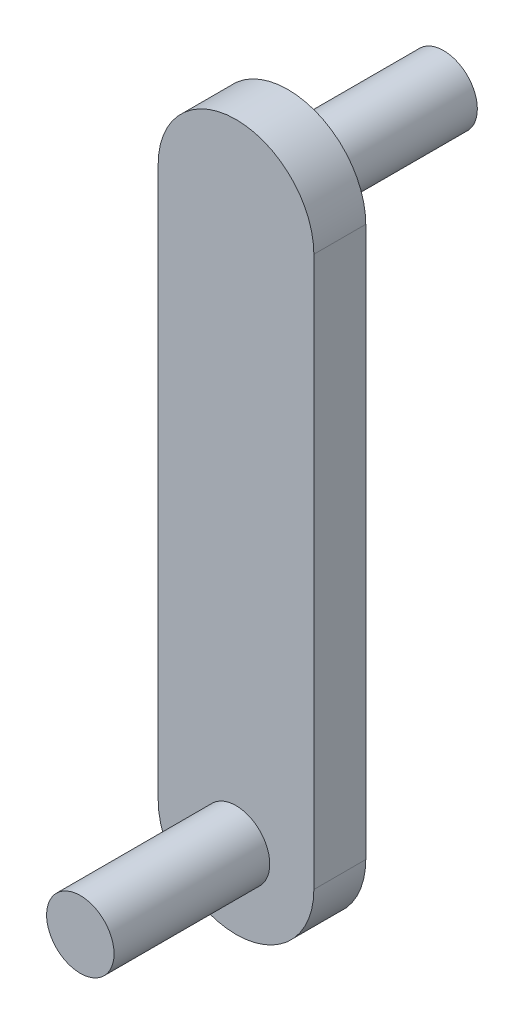
from build123d import *

# Parameters (mm, degrees)
BOSS_EXTRUDE1_DEPTH = 2.5
SKETCH1_3_R         = 3.25
BOSS_EXTRUDE2_DEPTH = 17.5
SKETCH1_4_R         = 3.25
BOSS_EXTRUDE3_DEPTH = 17.5


with BuildPart() as part:
    # Sketch1 → Boss-Extrude1 (new, symmetric)
    with BuildSketch(Plane.XY):
        with BuildLine():
            Line((7.5, -53), (7.5, 0))
            ThreePointArc((7.5, 0), (0, 7.5), (-7.5, 0))
            Line((-7.5, 0), (-7.5, -53))
            ThreePointArc((-7.5, -53), (0, -60.5), (7.5, -53))
        make_face()
    extrude(amount=BOSS_EXTRUDE1_DEPTH, both=True)

    # Sketch1<3> → Boss-Extrude2 (add)
    with BuildSketch(Plane.XY):
        Circle(SKETCH1_3_R)
    extrude(amount=-BOSS_EXTRUDE2_DEPTH)

    # Sketch1<4> → Boss-Extrude3 (add)
    with BuildSketch(Plane.XY):
        with Locations((0, -53)):
            Circle(SKETCH1_4_R)
    extrude(amount=BOSS_EXTRUDE3_DEPTH)


solid = part.part
